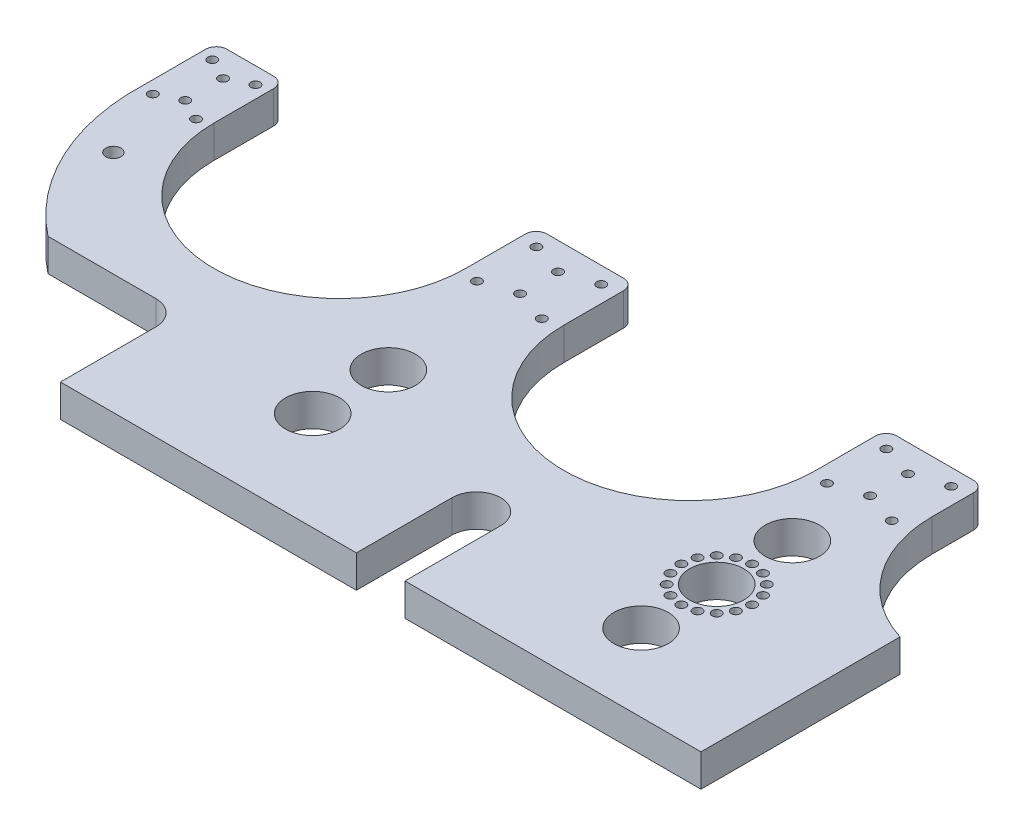
from build123d import *

# Parameters (mm, degrees)
SKETCH1_R           = 4.25
SKETCH1_R_2         = 25.1
SKETCH1_R_3         = 7
BOSS_EXTRUDE1_DEPTH = 30


with BuildPart() as part:
    # Sketch1 → Boss-Extrude1 (new body)
    with BuildSketch(Plane(origin=(0, 0, 0), x_dir=(1, 0, 0), z_dir=(0, 1, 0))):
        with BuildLine():
            Line((0, 0), (273.87, 0))
            Line((273.87, 0), (273.87, 88.502095305))
            ThreePointArc((273.87, 88.502095305), (296.37, 111.002095305), (318.87, 88.502095305))
            Line((318.87, 88.502095305), (318.87, 0))
            Line((318.87, 0), (592.74, 0))
            Line((592.74, 0), (592.74, 184.192095305))
            ThreePointArc((592.74, 184.192095305), (533.806093864, 226.410155161), (511.25, 295.307125341))
            Line((511.25, 295.307125341), (511.25, 333.742095305))
            ThreePointArc((511.25, 333.742095305), (508.321067812, 340.813163117), (501.25, 343.742095305))
            Line((501.25, 343.742095305), (430.37, 343.742095305))
            ThreePointArc((430.37, 343.742095305), (423.298932188, 340.813163117), (420.37, 333.742095305))
            Line((420.37, 333.742095305), (420.37, 278.472002111))
            ThreePointArc((420.37, 278.472002111), (303.87, 161.972002111), (187.37, 278.472002111))
            Line((187.37, 278.472002111), (187.37, 333.742095305))
            ThreePointArc((187.37, 333.742095305), (184.441067812, 340.813163117), (177.37, 343.742095305))
            Line((177.37, 343.742095305), (106.5, 343.742095305))
            ThreePointArc((106.5, 343.742095305), (99.428932188, 340.813163117), (96.5, 333.742095305))
            Line((96.5, 333.742095305), (96.5, 278.472002111))
            ThreePointArc((96.5, 278.472002111), (-20, 161.972002111), (-136.5, 278.472002111))
            Line((-136.5, 278.472002111), (-136.5, 333.742095305))
            ThreePointArc((-136.5, 333.742095305), (-139.428932188, 340.813163117), (-146.5, 343.742095305))
            Line((-146.5, 343.742095305), (-189.5, 343.742095305))
            ThreePointArc((-189.5, 343.742095305), (-196.571067812, 340.813163117), (-199.5, 333.742095305))
            Line((-199.5, 333.742095305), (-199.5, 260.976228759))
            ThreePointArc((-199.5, 260.976228759), (-177.402461095, 177.567779789), (-122.5, 111.002095305))
            Line((-122.5, 111.002095305), (-22.5, 111.002095305))
            ThreePointArc((-22.5, 111.002095305), (-6.590097423, 104.411997882), (0, 88.502095305))
            Line((0, 88.502095305), (0, 0))
        make_face()
        with Locations(Location((-188, 328.49, 0), (0, 0, 270))):
            Circle(SKETCH1_R, mode=Mode.SUBTRACT)
        with Locations(Location((-148, 328.49, 0), (0, 0, 270))):
            Circle(SKETCH1_R, mode=Mode.SUBTRACT)
        with Locations(Location((-188, 273.49, 0), (0, 0, 270))):
            Circle(SKETCH1_R, mode=Mode.SUBTRACT)
        with Locations(Location((-148, 273.49, 0), (0, 0, 270))):
            Circle(SKETCH1_R, mode=Mode.SUBTRACT)
        with Locations(Location((-168, 318.49, 0), (0, 0, 270))):
            Circle(SKETCH1_R, mode=Mode.SUBTRACT)
        with Locations(Location((-168, 283.49, 0), (0, 0, 270))):
            Circle(SKETCH1_R, mode=Mode.SUBTRACT)
        with Locations(Location((111.935, 328.49, 0), (0, 0, 270))):
            Circle(SKETCH1_R, mode=Mode.SUBTRACT)
        with Locations(Location((171.935, 328.49, 0), (0, 0, 270))):
            Circle(SKETCH1_R, mode=Mode.SUBTRACT)
        with Locations(Location((111.935, 273.49, 0), (0, 0, 270))):
            Circle(SKETCH1_R, mode=Mode.SUBTRACT)
        with Locations(Location((171.935, 273.49, 0), (0, 0, 270))):
            Circle(SKETCH1_R, mode=Mode.SUBTRACT)
        with Locations(Location((141.935, 318.49, 0), (0, 0, 270))):
            Circle(SKETCH1_R, mode=Mode.SUBTRACT)
        with Locations(Location((141.935, 283.49, 0), (0, 0, 270))):
            Circle(SKETCH1_R, mode=Mode.SUBTRACT)
        with Locations(Location((435.81, 328.49, 0), (0, 0, 270))):
            Circle(SKETCH1_R, mode=Mode.SUBTRACT)
        with Locations(Location((495.81, 328.49, 0), (0, 0, 270))):
            Circle(SKETCH1_R, mode=Mode.SUBTRACT)
        with Locations(Location((435.81, 273.49, 0), (0, 0, 270))):
            Circle(SKETCH1_R, mode=Mode.SUBTRACT)
        with Locations(Location((495.81, 273.49, 0), (0, 0, 270))):
            Circle(SKETCH1_R, mode=Mode.SUBTRACT)
        with Locations(Location((465.81, 318.49, 0), (0, 0, 270))):
            Circle(SKETCH1_R, mode=Mode.SUBTRACT)
        with Locations(Location((465.81, 283.49, 0), (0, 0, 270))):
            Circle(SKETCH1_R, mode=Mode.SUBTRACT)
        with Locations(Location((465.81, 71.5, 0), (0, 0, 270))):
            Circle(SKETCH1_R_2, mode=Mode.SUBTRACT)
        with Locations(Location((465.81, 141.5, 0), (0, 0, 270))):
            Circle(SKETCH1_R_2, mode=Mode.SUBTRACT)
        with Locations(Location((465.81, 211.5, 0), (0, 0, 270))):
            Circle(SKETCH1_R_2, mode=Mode.SUBTRACT)
        with Locations(Location((465.81, 174.25, 0), (0, 0, 270))):
            Circle(SKETCH1_R, mode=Mode.SUBTRACT)
        with Locations(Location((453.27711759, 171.75705469, 0), (0, 0, 270))):
            Circle(SKETCH1_R, mode=Mode.SUBTRACT)
        with Locations(Location((442.652252916, 164.657747084, 0), (0, 0, 270))):
            Circle(SKETCH1_R, mode=Mode.SUBTRACT)
        with Locations(Location((435.55294531, 154.03288241, 0), (0, 0, 270))):
            Circle(SKETCH1_R, mode=Mode.SUBTRACT)
        with Locations(Location((433.06, 141.5, 0), (0, 0, 270))):
            Circle(SKETCH1_R, mode=Mode.SUBTRACT)
        with Locations(Location((453.27711759, 111.24294531, 0), (0, 0, 270))):
            Circle(SKETCH1_R, mode=Mode.SUBTRACT)
        with Locations(Location((442.652252916, 118.342252916, 0), (0, 0, 270))):
            Circle(SKETCH1_R, mode=Mode.SUBTRACT)
        with Locations(Location((435.55294531, 128.96711759, 0), (0, 0, 270))):
            Circle(SKETCH1_R, mode=Mode.SUBTRACT)
        with Locations(Location((465.81, 108.75, 0), (0, 0, 270))):
            Circle(SKETCH1_R, mode=Mode.SUBTRACT)
        with Locations(Location((478.34288241, 111.24294531, 0), (0, 0, 270))):
            Circle(SKETCH1_R, mode=Mode.SUBTRACT)
        with Locations(Location((488.967747084, 118.342252916, 0), (0, 0, 270))):
            Circle(SKETCH1_R, mode=Mode.SUBTRACT)
        with Locations(Location((496.06705469, 128.96711759, 0), (0, 0, 270))):
            Circle(SKETCH1_R, mode=Mode.SUBTRACT)
        with Locations(Location((498.56, 141.5, 0), (0, 0, 270))):
            Circle(SKETCH1_R, mode=Mode.SUBTRACT)
        with Locations(Location((496.06705469, 154.03288241, 0), (0, 0, 270))):
            Circle(SKETCH1_R, mode=Mode.SUBTRACT)
        with Locations(Location((488.967747084, 164.657747084, 0), (0, 0, 270))):
            Circle(SKETCH1_R, mode=Mode.SUBTRACT)
        with Locations(Location((478.34288241, 171.75705469, 0), (0, 0, 270))):
            Circle(SKETCH1_R, mode=Mode.SUBTRACT)
        with Locations(Location((141.935, 161.5, 0), (0, 0, 270))):
            Circle(SKETCH1_R_2, mode=Mode.SUBTRACT)
        with Locations(Location((141.935, 91.5, 0), (0, 0, 270))):
            Circle(SKETCH1_R_2, mode=Mode.SUBTRACT)
        with Locations(Location((-159.5, 208.502095305, 0), (0, 0, 270))):
            Circle(SKETCH1_R_3, mode=Mode.SUBTRACT)
    extrude(amount=BOSS_EXTRUDE1_DEPTH)


solid = part.part
